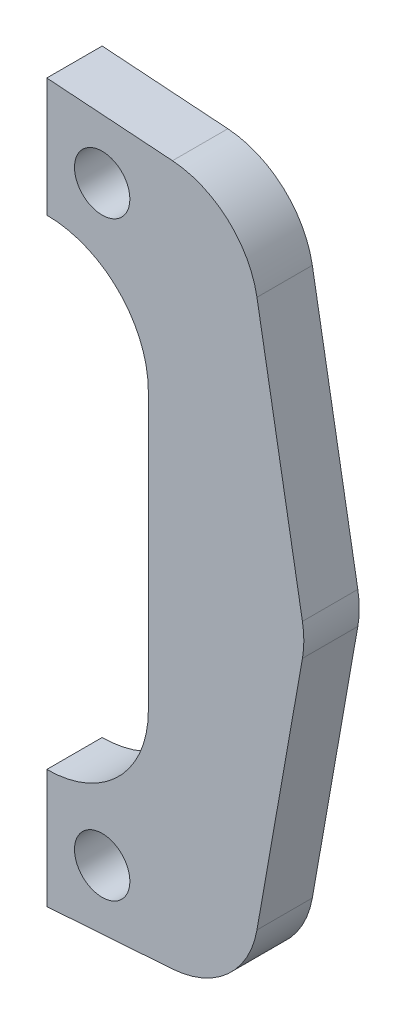
from build123d import *

# Parameters (mm, degrees)
SKETCH1_R           = 1.5
BOSS_EXTRUDE1_DEPTH = 3


with BuildPart() as part:
    # Sketch1 → Boss-Extrude1 (new body)
    with BuildSketch(Plane.XY):
        with BuildLine():
            Line((84.808392572, 18.957643404), (78, 19.433732591))
            Line((78, 19.433732591), (78, 13))
            ThreePointArc((78, 13), (81.889087297, 11.389087297), (83.5, 7.5))
            Line((83.5, 7.5), (83.5, -7.5))
            ThreePointArc((83.5, -7.5), (81.889087297, -11.389087297), (78, -13))
            Line((78, -13), (78, -19.433732591))
            Line((78, -19.433732591), (84.808392572, -18.957643404))
            ThreePointArc((84.808392572, -18.957643404), (87.805263235, -17.68554728), (89.383648968, -14.838064041))
            Line((89.383648968, -14.838064041), (91.846905706, -0.868240888))
            ThreePointArc((91.846905706, -0.868240888), (91.922866941, 0), (91.846905706, 0.868240888))
            Line((91.846905706, 0.868240888), (89.383648968, 14.838064041))
            ThreePointArc((89.383648968, 14.838064041), (87.805263235, 17.68554728), (84.808392572, 18.957643404))
        make_face()
        with Locations((81, -16)):
            Circle(SKETCH1_R, mode=Mode.SUBTRACT)
        with Locations((81, 16)):
            Circle(SKETCH1_R, mode=Mode.SUBTRACT)
    extrude(amount=BOSS_EXTRUDE1_DEPTH)


solid = part.part
